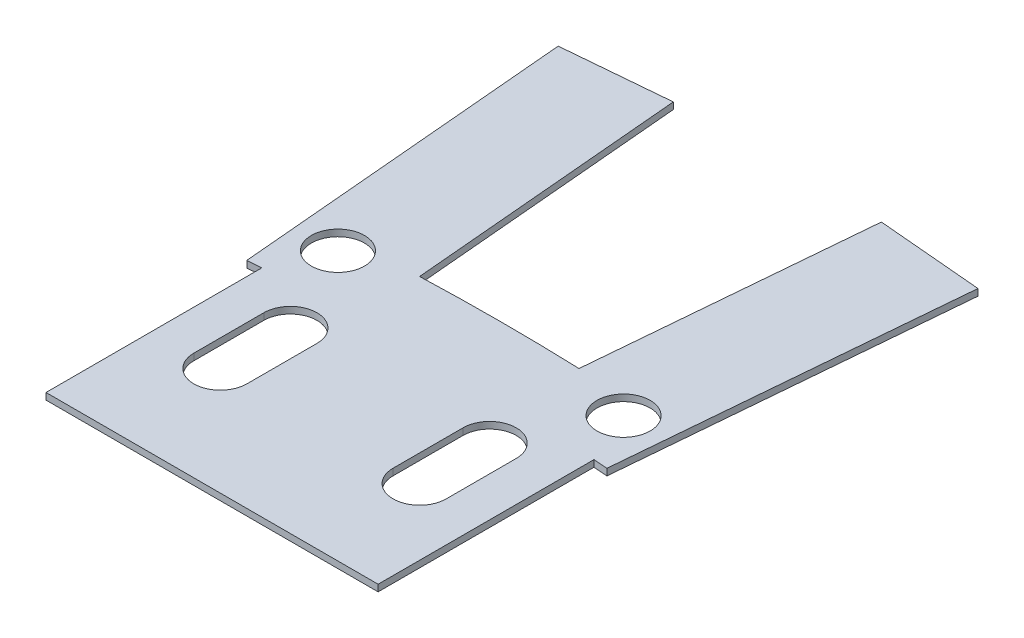
from build123d import *

# Parameters (mm, degrees)
SKETCH1_R           = 4
BOSS_EXTRUDE1_DEPTH = 0.5


with BuildPart() as part:
    # Sketch1 → Boss-Extrude1 (new, symmetric)
    with BuildSketch(Plane(origin=(0, 0, 0), x_dir=(1, 0, 0), z_dir=(0, 1, 0))):
        with BuildLine():
            Line((25, 325.804578988), (25, 293.304578988))
            Line((25, 293.304578988), (-25, 293.304578988))
            Line((-25, 293.304578988), (-25, 325.804578988))
            ThreePointArc((-25, 325.804578988), (-26.053340487, 325.722039688), (-27.106408582, 325.636094902))
            Line((-27.106408582, 325.636094902), (-27.946991052, 335.243996502))
            Line((-27.946991052, 335.243996502), (-31.601486967, 377.015075947))
            Line((-31.601486967, 377.015075947), (-15.662371798, 378.409567831))
            Line((-15.662371798, 378.409567831), (-12, 336.548466633))
            ThreePointArc((-12, 336.548466633), (0, 336.762335175), (12, 336.548466633))
            Line((12, 336.548466633), (15.662371798, 378.409567831))
            Line((15.662371798, 378.409567831), (31.601486967, 377.015075947))
            Line((31.601486967, 377.015075947), (27.946991052, 335.243996502))
            Line((27.946991052, 335.243996502), (27.106408582, 325.636094902))
            ThreePointArc((27.106408582, 325.636094902), (26.053340487, 325.722039688), (25, 325.804578988))
        make_face()
        with Locations(Location((-21.5, 333.754934474, 0), (0, 0, 270))):
            Circle(SKETCH1_R, mode=Mode.SUBTRACT)
        with Locations(Location((21.5, 333.754934474, 0), (0, 0, 90))):
            Circle(SKETCH1_R, mode=Mode.SUBTRACT)
        with BuildLine():
            Line((-19, 320.098149951), (-19, 309.554578988))
            ThreePointArc((-19, 309.554578988), (-15, 305.554578988), (-11, 309.554578988))
            Line((-11, 309.554578988), (-11, 320.098149951))
            ThreePointArc((-11, 320.098149951), (-15, 324.098149951), (-19, 320.098149951))
        make_face(mode=Mode.SUBTRACT)
        with BuildLine():
            Line((19, 320.098149951), (19, 309.554578988))
            ThreePointArc((19, 309.554578988), (15, 305.554578988), (11, 309.554578988))
            Line((11, 309.554578988), (11, 320.098149951))
            ThreePointArc((11, 320.098149951), (15, 324.098149951), (19, 320.098149951))
        make_face(mode=Mode.SUBTRACT)
    extrude(amount=BOSS_EXTRUDE1_DEPTH, both=True)


solid = part.part
